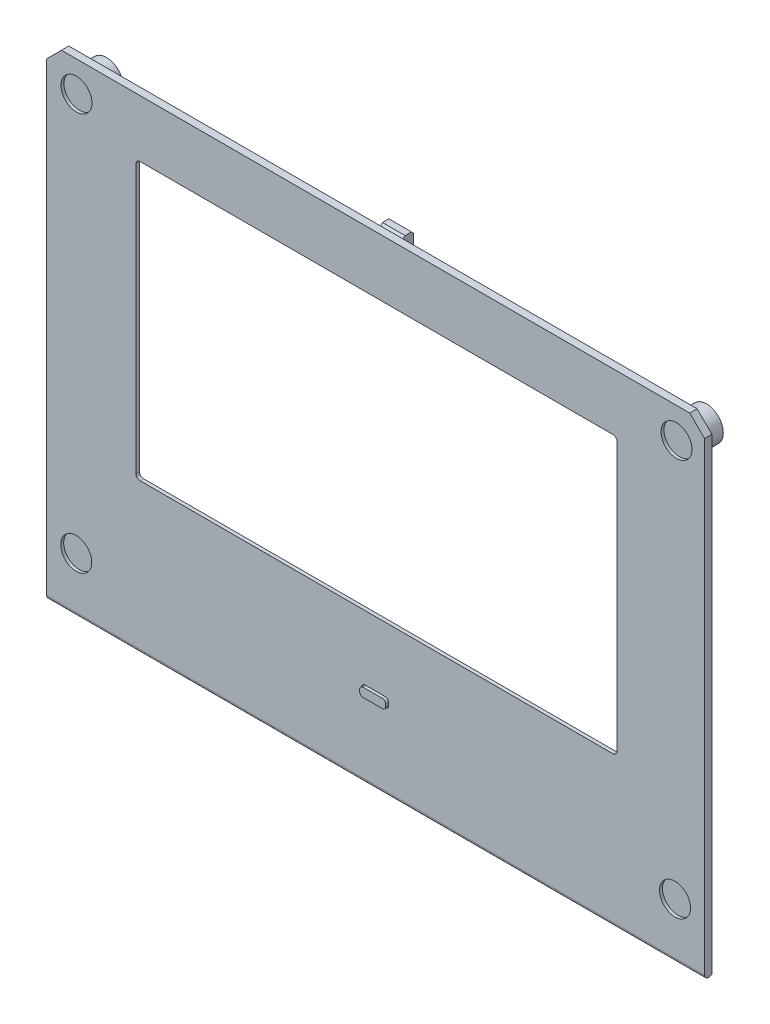
from build123d import *

# Parameters (mm, degrees)
SKETCH1_W            = 99
SKETCH1_H            = 59
BOSS_EXTRUDE1_DEPTH  = 1.5
BOSS_EXTRUDE2_DEPTH  = 133.760231922
CUT_EXTRUDE1_DEPTH   = 0.8
SKETCH4_R            = 1.5
CUT_EXTRUDE2_DEPTH   = 2
SKETCH5_R            = 3.399812147
SKETCH5_R_2          = 1.62500056
BOSS_EXTRUDE3_DEPTH  = 6.111397409
SKETCH6_R            = 3.5
CUT_EXTRUDE5_DEPTH   = 10
SKETCH7_R            = 3.5
SKETCH7_W            = 5.5
SKETCH7_H            = 2
BOSS_EXTRUDE4_DEPTH  = 0.8
FILLET1_R            = 0.8
SKETCH8_R            = 3.25
BOSS_EXTRUDE5_DEPTH  = 1.5
BOSS_EXTRUDE6_DEPTH  = 1.3
SKETCH10_R           = 3.15
CUT_EXTRUDE6_DEPTH   = 0.6
SKETCH11_R           = 1.75
BOSS_EXTRUDE7_DEPTH  = 4.211398277
SKETCH12_R           = 1.62500056
SKETCH12_R_2         = 1.5
BOSS_EXTRUDE8_DEPTH  = 0.3
SKETCH13_W           = 99
SKETCH13_H           = 59
SKETCH13_W_2         = 97.8
SKETCH13_H_2         = 56.2
BOSS_EXTRUDE9_DEPTH  = 0.7
FILLET2_R            = 0.8
FILLET3_R            = 0.8
SKETCH14_W           = 4.6
SKETCH14_H           = 2
BOSS_EXTRUDE10_DEPTH = 3.700797235
SKETCH15_W           = 4.6
SKETCH15_H           = 2.100000097
BOSS_EXTRUDE11_DEPTH = 1
CHAMFER1_SIZE        = 0.4
BOSS_EXTRUDE12_DEPTH = 4.6


with BuildPart() as part:
    # Sketch1 → Boss-Extrude1 (new body)
    with BuildSketch(Plane.XY):
        Polygon((63.7, 42.199999637), (-64.060231922, 42.199999637), (-67.060231922, 39.199999637), (-67.060231922, -42.134474378), (-67.060231922, -55.300000363), (66.7, -55.300000363), (66.7, -42.134474378), (66.7, 39.199999637), align=None)
        with Locations((0, 2.5)):
            Rectangle(SKETCH1_W, SKETCH1_H, mode=Mode.SUBTRACT)
    extrude(amount=BOSS_EXTRUDE1_DEPTH)

    # Sketch2 → Boss-Extrude2 (add)
    with BuildSketch(Plane.ZY.offset(67.060231922)):
        Polygon((0, -55.89119006), (1.499999976, -56.437145477), (1.5, -55.300000363), (0, -55.300000363), align=None)
    extrude(amount=-BOSS_EXTRUDE2_DEPTH)

    # Sketch3 → Cut-Extrude1 (cut)
    with BuildSketch(Plane(origin=(0, 0, 0), x_dir=(-1, 0, 0), z_dir=(0, 0, -1))):
        Polygon((54.499870171, -35.499884466), (54.499876378, 35.500115534), (-54.500123622, 35.500125063), (-54.500129829, -35.499874937), align=None)
    extrude(amount=-CUT_EXTRUDE1_DEPTH, mode=Mode.SUBTRACT)

    # Sketch4 → Cut-Extrude2 (cut)
    with BuildSketch(Plane.XY.offset(1.5)):
        with Locations((60.7, -44.894025617)):
            Circle(SKETCH4_R)
        with Locations((-61.060231922, -44.894025617)):
            Circle(SKETCH4_R)
        with BuildLine():
            add(Edge.make_bspline(
                [(-62.62500256, 36.000001036), (-62.62500256, 32.749999916), (-59.37500144, 32.749999916), (-59.37500144, 36.000001036), (-59.37500144, 39.250002156), (-62.62500256, 39.250002156), (-62.62500256, 36.000001036)],
                knots=[0, 0, 0, 0, 0.5, 0.5, 0.5, 1, 1, 1, 1], degree=3, weights=[1, 0.333333333, 0.333333333, 1, 0.333333333, 0.333333333, 1]))
        make_face()
        with BuildLine():
            add(Edge.make_bspline(
                [(59.37499728, 36.000001036), (59.37499728, 32.749999916), (62.6249984, 32.749999916), (62.6249984, 36.000001036), (62.6249984, 39.250002156), (59.37499728, 39.250002156), (59.37499728, 36.000001036)],
                knots=[0, 0, 0, 0, 0.5, 0.5, 0.5, 1, 1, 1, 1], degree=3, weights=[1, 0.333333333, 0.333333333, 1, 0.333333333, 0.333333333, 1]))
        make_face()
    extrude(amount=-CUT_EXTRUDE2_DEPTH, mode=Mode.SUBTRACT)

    # Sketch5 → Boss-Extrude3 (add)
    # profile 1 of 2: a face of its own
    with BuildSketch(Plane.XY.offset(1.5)):
        with Locations((-61.000002, 36.000001036)):
            Circle(SKETCH5_R)
        with Locations(Location((-61.000002, 36.000001036, 0), (0, 0, 90))):
            Circle(SKETCH5_R_2, mode=Mode.SUBTRACT)
    # profile 2 of 2: a face of its own
    with BuildSketch(Plane.XY.offset(1.5)):
        with Locations((61.000187857, 36.000187857)):
            Circle(SKETCH5_R)
        with Locations(Location((60.99999784, 36.000001036, 0), (0, 0, 90))):
            Circle(SKETCH5_R_2, mode=Mode.SUBTRACT)
    extrude(amount=-BOSS_EXTRUDE3_DEPTH)

    # Sketch6 → Cut-Extrude5 (cut)
    with BuildSketch(Plane.XY.offset(1.5)):
        with Locations((-0.280115961, -39.700000383)):
            Circle(SKETCH6_R)
    extrude(amount=-CUT_EXTRUDE5_DEPTH, mode=Mode.SUBTRACT)

    # Sketch7 → Boss-Extrude4 (add)
    with BuildSketch(Plane.XY.offset(1.5)):
        with Locations((-0.280115961, -39.700000383)):
            Circle(SKETCH7_R)
        with Locations((-0.280115961, -39.700000383)):
            Rectangle(SKETCH7_W, SKETCH7_H, mode=Mode.SUBTRACT)
    extrude(amount=-BOSS_EXTRUDE4_DEPTH)

    # Fillet1
    fillet1_edges = [part.edges().sort_by_distance(p)[0] for p in [
        (2.469884039, -40.700000383, 1.1),
        (-3.030115961, -40.700000383, 1.1),
        (-3.030115961, -38.700000383, 1.1),
        (2.469884039, -38.700000383, 1.1),
    ]]
    fillet(fillet1_edges, radius=FILLET1_R)

    # Sketch10 → Cut-Extrude6 (cut)
    with BuildSketch(Plane.XY.offset(1.5)):
        with Locations((-61.000002, 36.000001036)):
            Circle(SKETCH10_R)
        with Locations((-61.060231922, -44.894025617)):
            Circle(SKETCH10_R)
        with Locations((60.7, -44.894025617)):
            Circle(SKETCH10_R)
        with Locations((60.99999784, 36.000001036)):
            Circle(SKETCH10_R)
    extrude(amount=-CUT_EXTRUDE6_DEPTH, mode=Mode.SUBTRACT)

    # Sketch11 → Boss-Extrude7 (add)
    with BuildSketch(Plane(origin=(0, 0, 0), x_dir=(-1, 0, 0), z_dir=(0, 0, -1))):
        with Locations(Location((62.649814147, 16.142402615, 0), (0, 0, 180))):
            Circle(SKETCH11_R)
        with Locations(Location((56.249874696, 16.260173458, 0), (0, 0, 179.999994991))):
            Circle(SKETCH11_R)
        with Locations(Location((59.560231922, 28.999999637, 0), (0, 0, 180))):
            Circle(SKETCH11_R)
    extrude(amount=BOSS_EXTRUDE7_DEPTH)

    # Sketch12 → Boss-Extrude8 (add)
    with BuildSketch(Plane.XY.offset(0.9)):
        with Locations((-61.000002, 36.000001036)):
            Circle(SKETCH12_R)
        with Locations((-61.060231922, -44.894025617)):
            Circle(SKETCH12_R_2)
        with Locations((60.99999784, 36.000001036)):
            Circle(SKETCH12_R)
        with Locations((60.7, -44.894025617)):
            Circle(SKETCH12_R_2)
    extrude(amount=-BOSS_EXTRUDE8_DEPTH)

    # Sketch13 → Boss-Extrude9 (add)
    with BuildSketch(Plane.XY.offset(1.5)):
        with Locations((0, 2.5)):
            Rectangle(SKETCH13_W, SKETCH13_H)
        with Locations((0, 2.5)):
            Rectangle(SKETCH13_W_2, SKETCH13_H_2, mode=Mode.SUBTRACT)
    extrude(amount=-BOSS_EXTRUDE9_DEPTH)

    # Fillet2
    fillet2_edges = [part.edges().sort_by_distance(p)[0] for p in [
        (48.9, -25.6, 1.15),
        (-48.9, -25.6, 1.15),
        (-48.9, 30.6, 1.15),
        (48.9, 30.6, 1.15),
    ]]
    fillet(fillet2_edges, radius=FILLET2_R)

    # Fillet3
    fillet3_edges = [part.edges().sort_by_distance(p)[0] for p in [
        (-0.180115961, -56.437145477, 1.499999976),
    ]]
    fillet(fillet3_edges, radius=FILLET3_R)

    # Sketch14 → Boss-Extrude10 (add)
    with BuildSketch(Plane(origin=(0, 0, 0), x_dir=(-1, 0, 0), z_dir=(0, 0, -1))):
        with Locations((0, 38.999999724)):
            Rectangle(SKETCH14_W, SKETCH14_H)
    extrude(amount=BOSS_EXTRUDE10_DEPTH)

    # Sketch15 → Boss-Extrude11 (add)
    with BuildSketch(Plane(origin=(0, 39.999999724, 0), x_dir=(1.0, 2.676820723074785e-12, 0), z_dir=(-2.676820723074785e-12, 1.0, 0))):
        with Locations((0, 2.650797187)):
            Rectangle(SKETCH15_W, SKETCH15_H)
    extrude(amount=BOSS_EXTRUDE11_DEPTH)

    # Chamfer1
    chamfer1_edges = [part.edges().sort_by_distance(p)[0] for p in [
        (0, 40.999999724, -3.700797235),
        (0, 40.999999724, -1.600797138),
    ]]
    chamfer(chamfer1_edges, length=CHAMFER1_SIZE)

    # Sketch16 → Boss-Extrude12 (add)
    with BuildSketch(Plane(origin=(2.3, 0, 0), x_dir=(0, 0, -1), z_dir=(1, 0, 0))):
        Polygon((3.700797322, 37.999999724), (0, 37.999999724), (0, 36.499999724), align=None)
    extrude(amount=-BOSS_EXTRUDE12_DEPTH)


with BuildPart() as body_2:
    # Sketch8 → Boss-Extrude5 (new body)
    with BuildSketch(Plane(origin=(0, 0, 0.7), x_dir=(-1, 0, 0), z_dir=(0, 0, -1))):
        with Locations((0.280115961, -39.700000383)):
            Circle(SKETCH8_R)
    extrude(amount=BOSS_EXTRUDE5_DEPTH)

    # Sketch9 → Boss-Extrude6 (add)
    with BuildSketch(Plane.XY.offset(0.7)):
        with BuildLine():
            Line((2.369884039, -39.900000383), (2.369884039, -39.500000383))
            ThreePointArc((2.369884039, -39.500000383), (2.164858786, -39.005025636), (1.669884039, -38.800000383))
            Line((1.669884039, -38.800000383), (-2.230115961, -38.800000383))
            ThreePointArc((-2.230115961, -38.800000383), (-2.725090708, -39.005025636), (-2.930115961, -39.500000383))
            Line((-2.930115961, -39.500000383), (-2.930115961, -39.900000383))
            ThreePointArc((-2.930115961, -39.900000383), (-2.725090708, -40.39497513), (-2.230115961, -40.600000383))
            Line((-2.230115961, -40.600000383), (1.669884039, -40.600000383))
            ThreePointArc((1.669884039, -40.600000383), (2.164858786, -40.39497513), (2.369884039, -39.900000383))
        make_face()
    extrude(amount=BOSS_EXTRUDE6_DEPTH)


solid = Compound([part.part, body_2.part])
